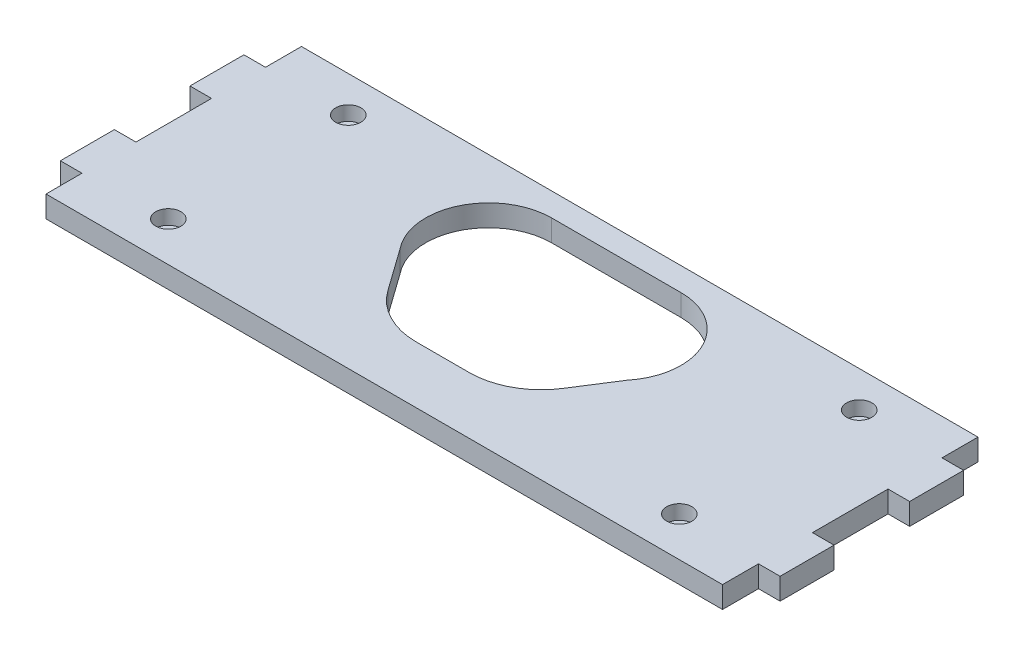
from build123d import *

# Parameters (mm, degrees)
BOSS_EXTRU_1_DEPTH      = 6
ESQUISSE2_R             = 17.5
ESQUISSE2_R_2           = 1.65
ENL_V_MAT_EXTRU_1_DEPTH = 107.283818147
ENL_V_MAT_EXTRU_3_DEPTH = 107.283818147
ESQUISSE6_R             = 3.5
ENL_V_MAT_EXTRU_4_DEPTH = 4
CONG_1_R                = 20


with BuildPart() as part:
    # Esquisse1 → Boss.-Extru.1 (new body)
    with BuildSketch(Plane(origin=(0, 0, 0), x_dir=(1, 0, 0), z_dir=(0, 1, 0))):
        Polygon((-94, -35.5), (-94, -25.5), (-100, -25.5), (-100, -10.5), (-94, -10.5), (-94, 10.5), (-100, 10.5), (-100, 25.5), (-94, 25.5), (-94, 35.5), (94, 35.5), (94, 25.5), (100, 25.5), (100, 10.5), (94, 10.5), (94, -10.5), (100, -10.5), (100, -25.5), (94, -25.5), (94, -35.5), align=None)
    extrude(amount=BOSS_EXTRU_1_DEPTH)

    # Esquisse2 → Enlèv. mat.-Extru.1 (cut, through all)
    with BuildSketch(Plane(origin=(0, 0, 0), x_dir=(-1, 0, 0), z_dir=(0, -1, 0))):
        with Locations(Location((18, 11.5, 0), (0, 0, 90))):
            Circle(ESQUISSE2_R)
        with Locations(Location((71, -24.5, 0), (0, 0, 90))):
            Circle(ESQUISSE2_R_2)
        with Locations(Location((71, 25.5, 0), (0, 0, 90))):
            Circle(ESQUISSE2_R_2)
        with Locations(Location((-71, 25.5, 0), (0, 0, 270))):
            Circle(ESQUISSE2_R_2)
        with Locations(Location((-71, -24.5, 0), (0, 0, 270))):
            Circle(ESQUISSE2_R_2)
        with Locations(Location((-18, 11.5, 0), (0, 0, 270))):
            Circle(ESQUISSE2_R)
    extrude(amount=-ENL_V_MAT_EXTRU_1_DEPTH, mode=Mode.SUBTRACT)

    # Esquisse5 → Enlèv. mat.-Extru.3 (cut, through all)
    with BuildSketch(Plane.XZ):
        Polygon((-31.565369037, -0.444197772), (-18, -29), (18, -29), (31.565369037, -0.444197772), (18.743702877, 19.662334717), (-17.256297123, 19.662334717), align=None)
    extrude(amount=-ENL_V_MAT_EXTRU_3_DEPTH, mode=Mode.SUBTRACT)

    # Esquisse6 → Enlèv. mat.-Extru.4 (cut)
    with BuildSketch(Plane(origin=(0, 6, 0), x_dir=(1, 0, 0), z_dir=(0, 1, 0))):
        with Locations(Location((71, -24.5, 0), (0, 0, 270))):
            Circle(ESQUISSE6_R)
        with Locations(Location((71, 25.5, 0), (0, 0, 270))):
            Circle(ESQUISSE6_R)
        with Locations(Location((-71, 25.5, 0), (0, 0, 270))):
            Circle(ESQUISSE6_R)
        with Locations(Location((-71, -24.5, 0), (0, 0, 270))):
            Circle(ESQUISSE6_R)
    extrude(amount=-ENL_V_MAT_EXTRU_4_DEPTH, mode=Mode.SUBTRACT)

    # Congé1
    cong_1_edges = [part.edges().sort_by_distance(p)[0] for p in [
        (-17.256297123, 3, 19.662334717),
        (18.743702877, 3, 19.662334717),
    ]]
    fillet(cong_1_edges, radius=CONG_1_R)


solid = part.part
